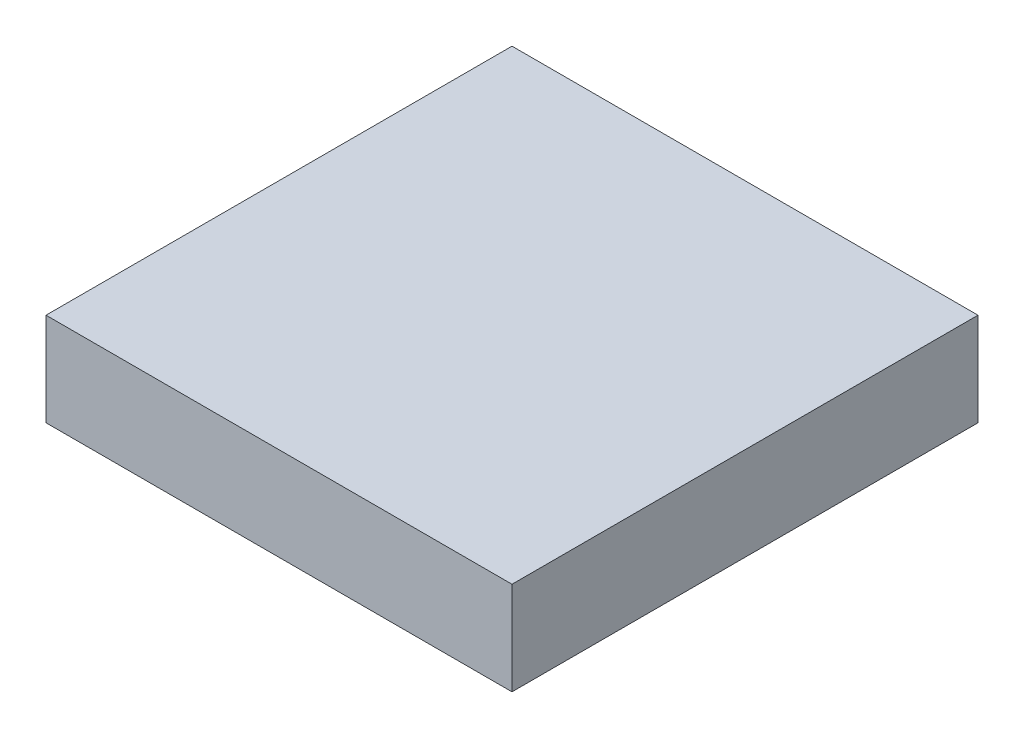
from build123d import *

# Parameters (mm, degrees)
SKETCH1_W           = 10
SKETCH1_H           = 10
BOSS_EXTRUDE1_DEPTH = 2


with BuildPart() as part:
    # Sketch1 → Boss-Extrude1 (new body)
    with BuildSketch(Plane(origin=(0, 0, 0), x_dir=(1, 0, 0), z_dir=(0, 1, 0))):
        Rectangle(SKETCH1_W, SKETCH1_H)
    extrude(amount=BOSS_EXTRUDE1_DEPTH)


solid = part.part
